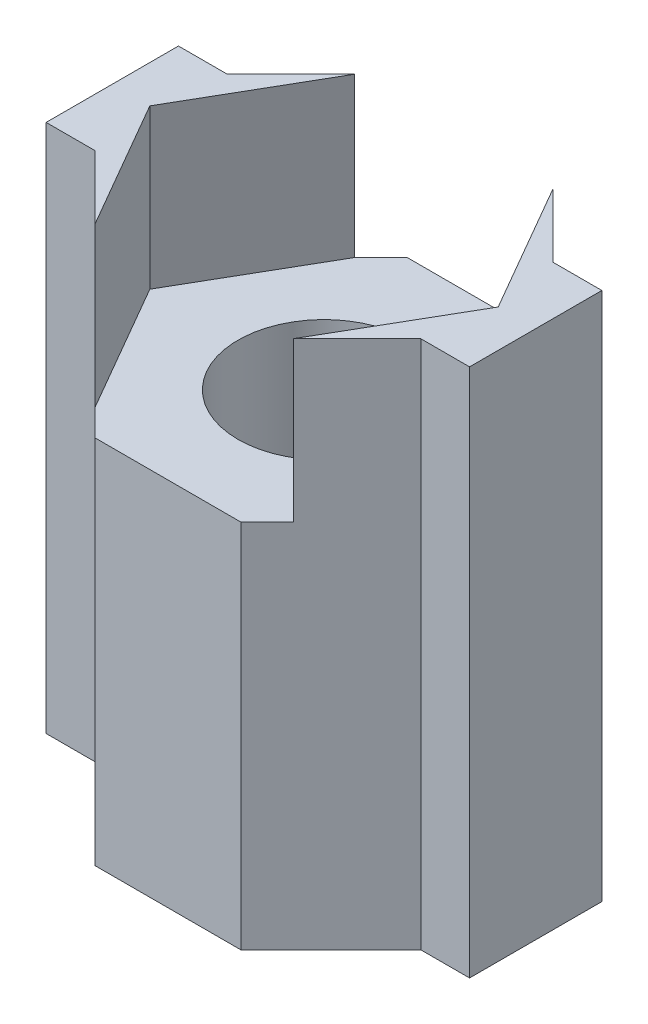
from build123d import *

# Parameters (mm, degrees)
RESSALTO_EXTRUS_O1_DEPTH = 20
CORTE_EXTRUS_O1_DEPTH    = 6
ESBO_O3_R                = 3.25
CORTE_EXTRUS_O2_DEPTH    = 18.170032033


with BuildPart() as part:
    # Esboço1 → Ressalto-extrusão1 (new body)
    with BuildSketch(Plane(origin=(0, 0, 0), x_dir=(1, 0, 0), z_dir=(0, 1, 0))):
        Polygon((-8, 2.5), (-6.156497116, 2.5), (-2.756497116, 5.9), (2.756497116, 5.9), (6.156497116, 2.5), (8, 2.5), (8, -2.5), (6.156497116, -2.5), (2.756497116, -5.9), (-2.756497116, -5.9), (-6.156497116, -2.5), (-8, -2.5), align=None)
    extrude(amount=RESSALTO_EXTRUS_O1_DEPTH)

    # Esboço2 → Corte-extrusão1 (cut)
    with BuildSketch(Plane(origin=(0, 20, 0), x_dir=(1, 0, 0), z_dir=(0, 1, 0))):
        Polygon((-3.290896534, 5.7), (-3.290896534, 6.558868729), (3.290896534, 6.558868729), (3.290896534, 5.7), (6.581793069, 0), (3.290896534, -5.7), (3.290896534, -6.558868729), (-3.290896534, -6.558868729), (-3.290896534, -5.7), (-6.581793069, 0), align=None)
    extrude(amount=-CORTE_EXTRUS_O1_DEPTH, mode=Mode.SUBTRACT)

    # Esboço3 → Corte-extrusão2 (cut, through all)
    with BuildSketch(Plane(origin=(0, 14, 0), x_dir=(1, 0, 0), z_dir=(0, 1, 0))):
        with Locations(Location((0, 0, 0), (0, 0, 270))):
            Circle(ESBO_O3_R)
    extrude(amount=-CORTE_EXTRUS_O2_DEPTH, mode=Mode.SUBTRACT)


solid = part.part
